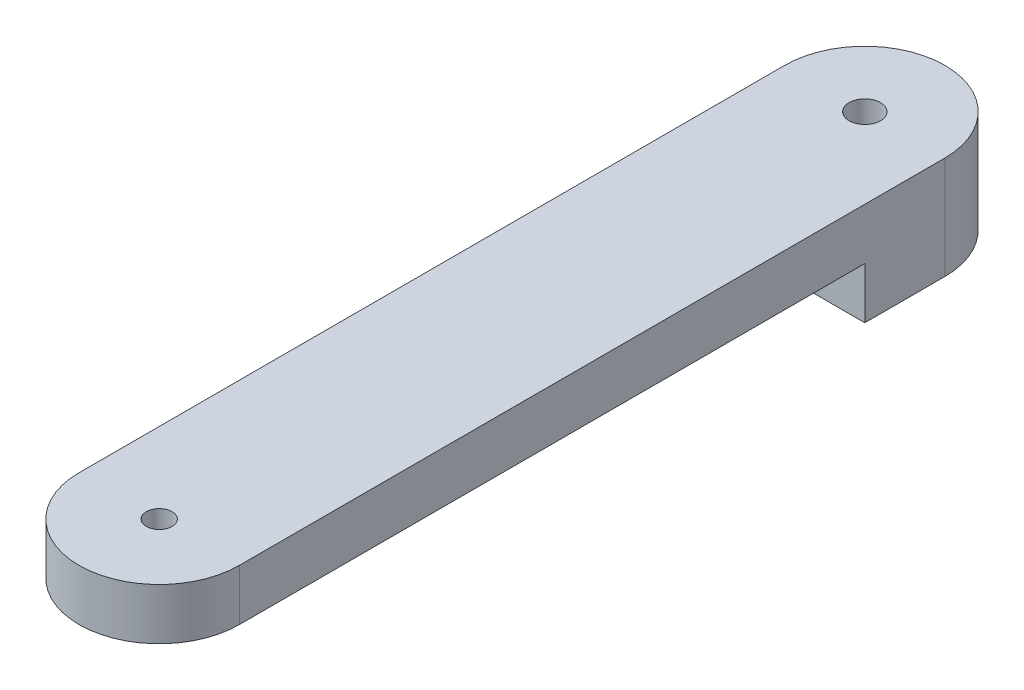
from build123d import *

# Parameters (mm, degrees)
SKETCH1_R               = 12.5
SKETCH1_R_2             = 2.45
BOSS_EXTRUDE1_DEPTH     = 8
CUT_EXTRUDE1_DEPTH      = 124.39570495
CUT_EXTRUDE1_DEPTH_BACK = 124.39570495
SKETCH2_R               = 2
BOSS_EXTRUDE2_START     = 8
BOSS_EXTRUDE2_DEPTH     = 8
CUT_EXTRUDE2_DEPTH      = 125.171252712
CUT_EXTRUDE2_DEPTH_BACK = 125.171252712
SKETCH4_R               = 2.45


with BuildPart() as part:
    # Sketch1 → Boss-Extrude1 (new body)
    # profile 1 of 3: a face of its own
    with BuildSketch(Plane(origin=(0, 0, 0), x_dir=(1, 0, 0), z_dir=(0, 1, 0))):
        with BuildLine():
            Line((12.5, 0), (12.5, 110))
            ThreePointArc((12.5, 110), (0, 97.5), (-12.5, 110))
            Line((-12.5, 110), (-12.5, 0))
            ThreePointArc((-12.5, 0), (0, 12.5), (12.5, 0))
        make_face()
    # profile 2 of 3: a face of its own
    with BuildSketch(Plane(origin=(0, 0, 0), x_dir=(1, 0, 0), z_dir=(0, 1, 0))):
        with Locations((0, 110)):
            Circle(SKETCH1_R)
        with Locations(Location((0, 110, 0), (0, 0, 270))):
            Circle(SKETCH1_R_2, mode=Mode.SUBTRACT)
    # profile 3 of 3: a face of its own
    with BuildSketch(Plane(origin=(0, 0, 0), x_dir=(1, 0, 0), z_dir=(0, 1, 0))):
        Circle(SKETCH1_R)
    extrude(amount=BOSS_EXTRUDE1_DEPTH)

    # Sketch2 → Cut-Extrude1 (cut, two sides: drawn at the far end of the back side and taken through both)
    with BuildSketch(Plane(origin=(0, 8, 0), x_dir=(1, 0, 0), z_dir=(0, 1, 0)).offset(-CUT_EXTRUDE1_DEPTH_BACK)):
        with Locations(Location((0, 0, 0), (0, 0, 270))):
            Circle(SKETCH2_R)
    extrude(amount=CUT_EXTRUDE1_DEPTH + CUT_EXTRUDE1_DEPTH_BACK, mode=Mode.SUBTRACT)

    # Sketch3 → Boss-Extrude2 (add)
    with BuildSketch(Plane.XZ.offset(BOSS_EXTRUDE2_START)):
        with BuildLine():
            Line((12.5, -110), (12.5, -97.5))
            Line((12.5, -97.5), (-12.5, -97.5))
            Line((-12.5, -97.5), (-12.5, -110))
            ThreePointArc((-12.5, -110), (0, -122.5), (12.5, -110))
        make_face()
    extrude(amount=-BOSS_EXTRUDE2_DEPTH)

    # Sketch4 → Cut-Extrude2 (cut, two sides: drawn at the far end of the back side and taken through both)
    with BuildSketch(Plane(origin=(0, 8, 0), x_dir=(1, 0, 0), z_dir=(0, 1, 0)).offset(-CUT_EXTRUDE2_DEPTH_BACK)):
        with Locations(Location((0, 110, 0), (0, 0, 270))):
            Circle(SKETCH4_R)
    extrude(amount=CUT_EXTRUDE2_DEPTH + CUT_EXTRUDE2_DEPTH_BACK, mode=Mode.SUBTRACT)


solid = part.part
